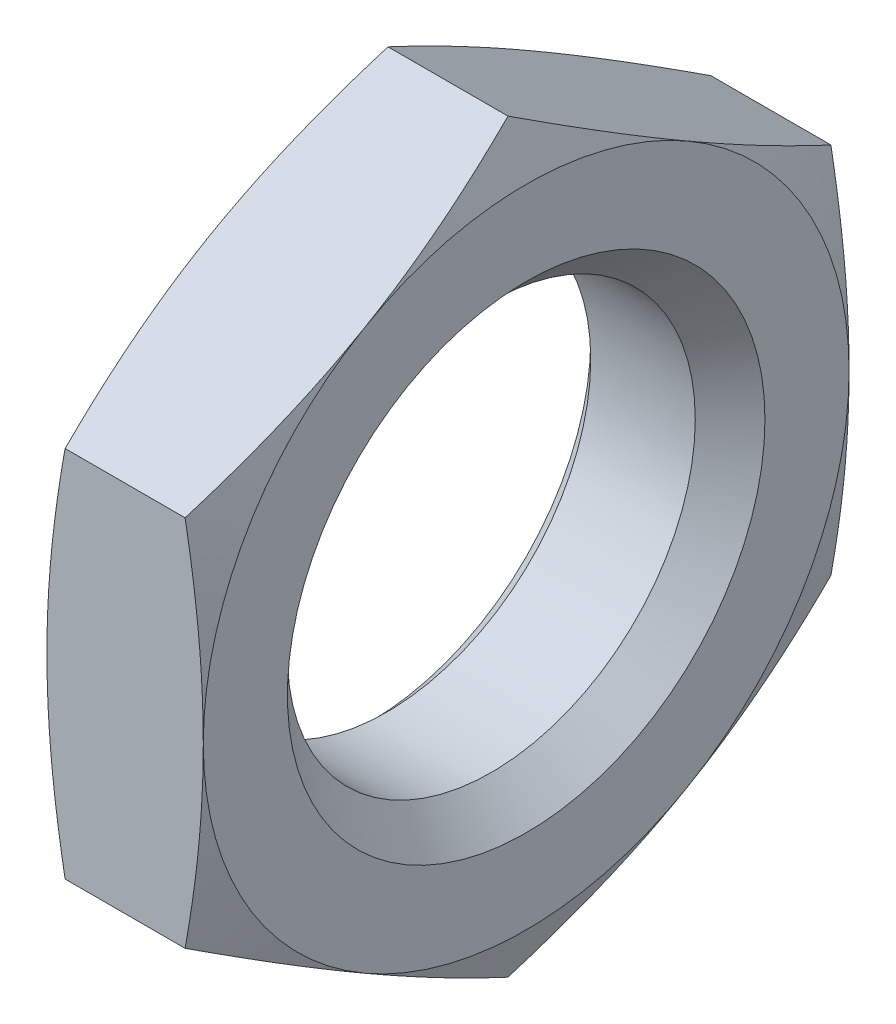
from build123d import *

# Parameters (mm, degrees)
RESSALTO_EXTRUS_O1_DEPTH = 4.6
CHANFRO1_SIZE            = 0.5
ESBO_O8_OUTSIDE_W        = 98.312
ESBO_O8_OUTSIDE_H        = 101.252
ESBO_O8_OUTSIDE_R        = 9.5
CORTE_EXTRUS_O1_DEPTH    = 13
CORTE_EXTRUS_O1_DRAFT    = -70
ESBO_O9_OUTSIDE_W        = 98.312
ESBO_O9_OUTSIDE_H        = 101.252
ESBO_O9_OUTSIDE_R        = 9.5
CORTE_EXTRUS_O2_DEPTH    = 13
CORTE_EXTRUS_O2_DRAFT    = -70


with BuildPart() as part:
    # Esboço1 → Ressalto-extrusão1 (new body)
    with BuildSketch(Plane(origin=(0, 0, 0), x_dir=(0, 0, -1), z_dir=(1, 0, 0))):
        Polygon((9.5, 5.484827557), (0, 10.969655115), (-9.5, 5.484827557), (-9.5, -5.484827557), (0, -10.969655115), (9.5, -5.484827557), align=None)
    extrude(amount=RESSALTO_EXTRUS_O1_DEPTH)

    # Esboço6 → Furo roscado de M141 (revolve, cut)
    with BuildSketch(Plane(origin=(4.6, 0, 0), x_dir=(0, 0, -1), z_dir=(0, 1, 0))):
        Polygon((0, 0), (0, 4.6), (6, 4.6), (6, 1.025), (7.025, 0), align=None)
    revolve(axis=Axis((10.95, 0, 0), (-1, 0, 0)), mode=Mode.SUBTRACT)

    # Chanfro1
    chanfro1_edges = [part.edges().sort_by_distance(p)[0] for p in [
        (0, 0, 6),
    ]]
    chamfer(chanfro1_edges, length=CHANFRO1_SIZE)


with BuildPart() as corte_extrus_o1_tool:
    # Esboço8 outside → Corte-extrusão1 (with draft: the straight prism first)
    with BuildSketch(Plane.ZY):
        Rectangle(ESBO_O8_OUTSIDE_W, ESBO_O8_OUTSIDE_H)
        Circle(ESBO_O8_OUTSIDE_R, mode=Mode.SUBTRACT)
    extrude(amount=-CORTE_EXTRUS_O1_DEPTH)
    # Corte-extrusão1: the draft: its side faces are tilted about the plane it starts from
    corte_extrus_o1_sides = [corte_extrus_o1_tool.faces().sort_by_distance(p)[0] for p in [
        (6.5, -50.626, 0),
        (6.5, 0, 49.156),
        (6.5, 50.626, 0),
        (6.5, 0, -49.156),
        (6.5, 0, -9.5),
    ]]
    draft(corte_extrus_o1_sides, Plane.ZY, CORTE_EXTRUS_O1_DRAFT)


with BuildPart() as part_1:
    add(part.part)

    # Corte-extrusão1: cut by corte_extrus_o1_tool
    add(corte_extrus_o1_tool.part, mode=Mode.SUBTRACT)


with BuildPart() as corte_extrus_o2_tool:
    # Esboço9 outside → Corte-extrusão2 (with draft: the straight prism first)
    with BuildSketch(Plane(origin=(4.6, 0, 0), x_dir=(0, 0, -1), z_dir=(1, 0, 0))):
        Rectangle(ESBO_O9_OUTSIDE_W, ESBO_O9_OUTSIDE_H)
        Circle(ESBO_O9_OUTSIDE_R, mode=Mode.SUBTRACT)
    extrude(amount=-CORTE_EXTRUS_O2_DEPTH)
    # Corte-extrusão2: the draft: its side faces are tilted about the plane it starts from
    corte_extrus_o2_sides = [corte_extrus_o2_tool.faces().sort_by_distance(p)[0] for p in [
        (-1.9, -50.626, 0),
        (-1.9, 0, -49.156),
        (-1.9, 50.626, 0),
        (-1.9, 0, 49.156),
        (-1.9, 0, 9.5),
    ]]
    draft(corte_extrus_o2_sides, Plane(origin=(4.6, 0, 0), x_dir=(0, 0, -1), z_dir=(1, 0, 0)), CORTE_EXTRUS_O2_DRAFT)


with BuildPart() as part_2:
    add(part_1.part)

    # Corte-extrusão2: cut by corte_extrus_o2_tool
    add(corte_extrus_o2_tool.part, mode=Mode.SUBTRACT)


solid = part_2.part
